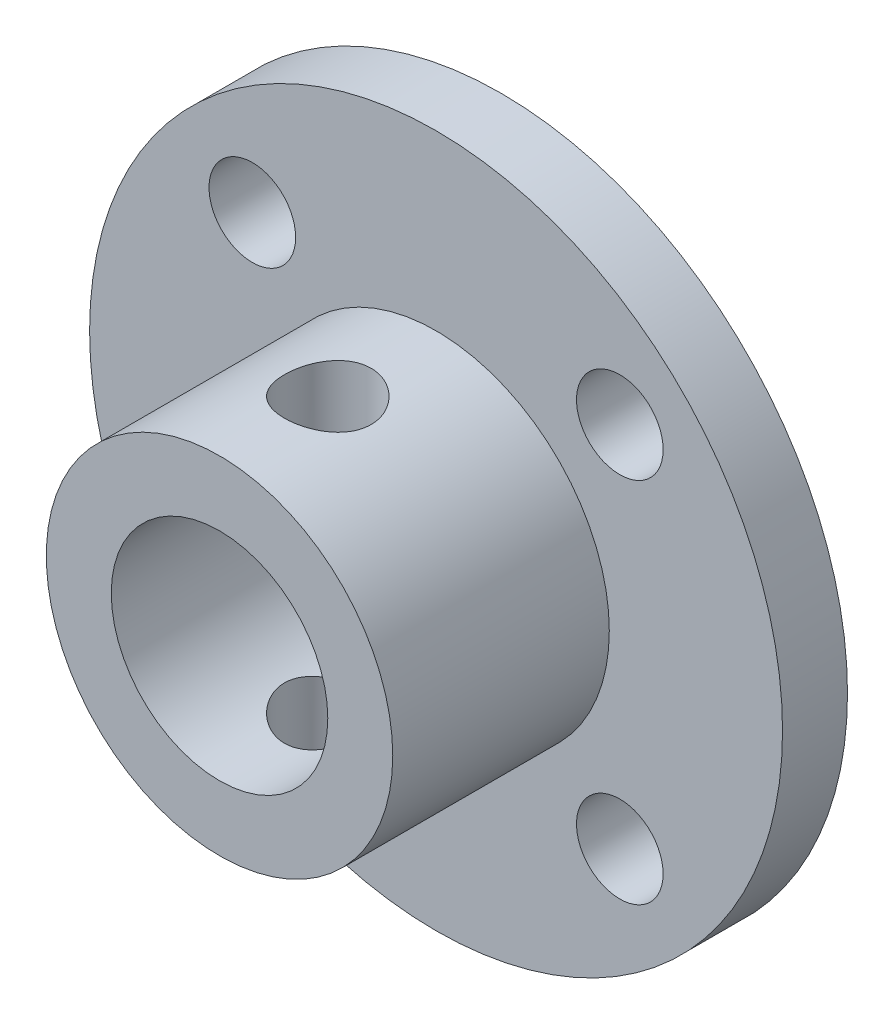
from build123d import *

# Parameters (mm, degrees)
SKETCH_2_R               = 16
SKETCH_2_R_2             = 5
SKETCH_2_R_3             = 2
EXTRUDE_1_DEPTH          = 3
SKETCH_3_R               = 8
SKETCH_3_R_2             = 5
EXTRUDE_2_DEPTH          = 10
CUT_EXTRUDE_1_DEPTH      = 10
CUT_EXTRUDE_1_DEPTH_BACK = 10
SKETCH_4_R               = 2


with BuildPart() as part:
    # 草图2 → 凸台-拉伸1 (new body)
    with BuildSketch(Plane.XY):
        Circle(SKETCH_2_R)
        Circle(SKETCH_2_R_2, mode=Mode.SUBTRACT)
        with Locations((8.485281374, -8.485281374)):
            Circle(SKETCH_2_R_3, mode=Mode.SUBTRACT)
        with Locations((-8.485281374, -8.485281374)):
            Circle(SKETCH_2_R_3, mode=Mode.SUBTRACT)
        with Locations((-8.485281374, 8.485281374)):
            Circle(SKETCH_2_R_3, mode=Mode.SUBTRACT)
        with Locations((8.485281374, 8.485281374)):
            Circle(SKETCH_2_R_3, mode=Mode.SUBTRACT)
    extrude(amount=EXTRUDE_1_DEPTH)

    # 草图3 → 凸台-拉伸2 (add)
    with BuildSketch(Plane.XY.offset(3)):
        Circle(SKETCH_3_R)
        Circle(SKETCH_3_R_2, mode=Mode.SUBTRACT)
    extrude(amount=EXTRUDE_2_DEPTH)

    # 草图4 → 切除-拉伸1 (cut, two sides: drawn at the far end of the back side and taken through both)
    with BuildSketch(Plane(origin=(0, 0, 0), x_dir=(1, 0, 0), z_dir=(0, 1, 0)).offset(-CUT_EXTRUDE_1_DEPTH_BACK)):
        with Locations((0, -8)):
            Circle(SKETCH_4_R)
    extrude(amount=CUT_EXTRUDE_1_DEPTH + CUT_EXTRUDE_1_DEPTH_BACK, mode=Mode.SUBTRACT)


solid = part.part
